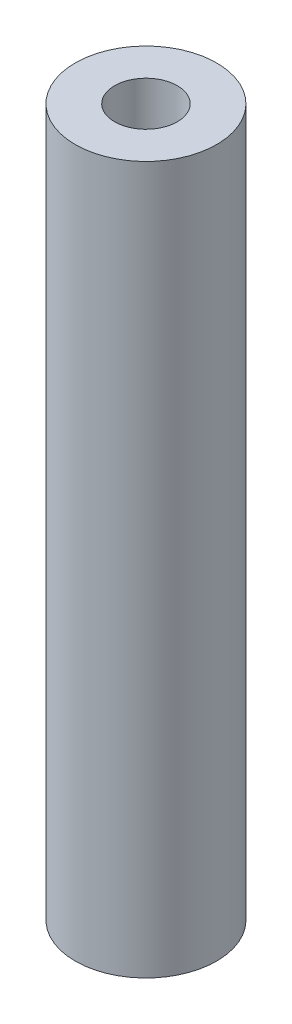
from build123d import *

# Parameters (mm, degrees)
SKETCH_2_R      = 3.5
SKETCH_2_R_2    = 1.55
EXTRUDE_1_DEPTH = 35


with BuildPart() as part:
    # 草图2 → 凸台-拉伸1 (new body)
    with BuildSketch(Plane(origin=(0, 0, 0), x_dir=(1, 0, 0), z_dir=(0, 1, 0))):
        with Locations(Location((0, 0, 0), (0, 0, 270))):
            Circle(SKETCH_2_R)
        with Locations(Location((0, 0, 0), (0, 0, 270))):
            Circle(SKETCH_2_R_2, mode=Mode.SUBTRACT)
    extrude(amount=EXTRUDE_1_DEPTH)


solid = part.part
